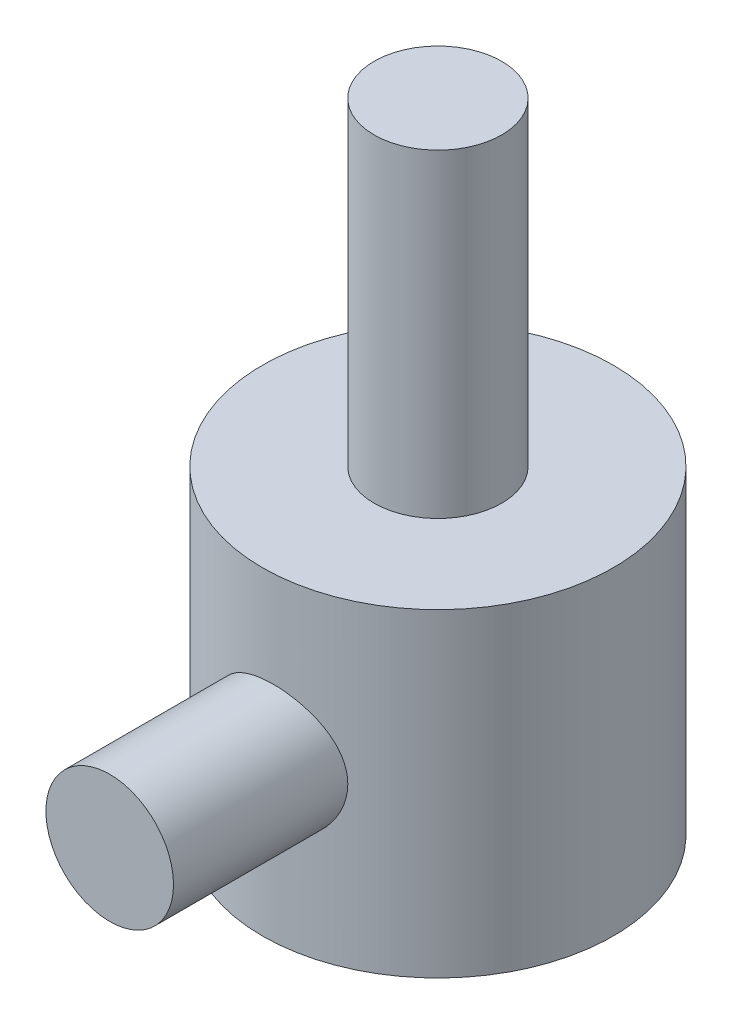
from build123d import *

# Parameters (mm, degrees)
SKETCH1_R                = 55
BOSS_EXTRUDE1_DEPTH      = 100
SKETCH2_R                = 20
BOSS_EXTRUDE2_DEPTH      = 100
BOSS_EXTRUDE3_DEPTH      = 50
BOSS_EXTRUDE3_DEPTH_BACK = 20
SKETCH3_R                = 20


with BuildPart() as part:
    # Sketch1 → Boss-Extrude1 (new body)
    with BuildSketch(Plane(origin=(0, 0, 0), x_dir=(1, 0, 0), z_dir=(0, 1, 0))):
        with Locations(Location((0, 0, 0), (0, 0, 270))):
            Circle(SKETCH1_R)
    extrude(amount=BOSS_EXTRUDE1_DEPTH)

    # Sketch2 → Boss-Extrude2 (add)
    with BuildSketch(Plane(origin=(0, 100, 0), x_dir=(1, 0, 0), z_dir=(0, 1, 0))):
        with Locations(Location((0, 0, 0), (0, 0, 270))):
            Circle(SKETCH2_R)
    extrude(amount=BOSS_EXTRUDE2_DEPTH)

    # Sketch3 → Boss-Extrude3 (add, two sides: drawn at the far end of the back side and taken through both)
    with BuildSketch(Plane.XY.offset(55).offset(-BOSS_EXTRUDE3_DEPTH_BACK)):
        with Locations((2.115721614, 50)):
            Circle(SKETCH3_R)
    extrude(amount=BOSS_EXTRUDE3_DEPTH + BOSS_EXTRUDE3_DEPTH_BACK)


solid = part.part
